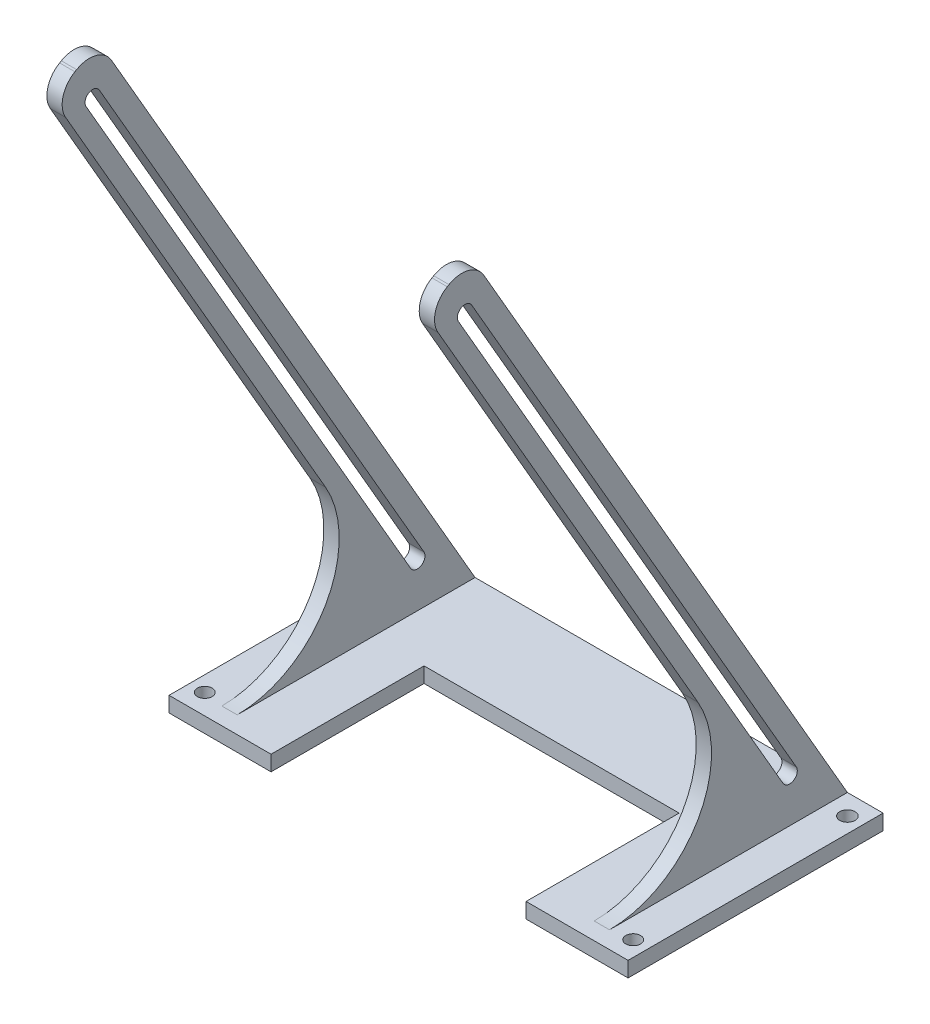
from build123d import *

# Parameters (mm, degrees)
SKETCH_1_R      = 1.448445572
SKETCH_1_R_2    = 1.5
EXTRUDE_1_DEPTH = 3
EXTRUDE_2_DEPTH = 3
SKETCH_5_W      = 10
SKETCH_5_H      = 30
EXTRUDE_3_DEPTH = 3


with BuildPart() as part:
    # 草图1 → 凸台-拉伸1 (new body)
    with BuildSketch(Plane(origin=(0, 0, 0), x_dir=(1, 0, 0), z_dir=(0, 1, 0))):
        Polygon((0, 0), (-35, 0), (-35, -30), (-45, -30), (-45, 20), (45, 20), (45, -30), (35, -30), (35, 0), align=None)
        with Locations(Location((-42, -26, 0), (0, 0, 270))):
            Circle(SKETCH_1_R, mode=Mode.SUBTRACT)
        with Locations(Location((-42, 16, 0), (0, 0, 270))):
            Circle(SKETCH_1_R_2, mode=Mode.SUBTRACT)
        with Locations(Location((42, -26, 0), (0, 0, 90))):
            Circle(SKETCH_1_R, mode=Mode.SUBTRACT)
        with Locations(Location((42, 16, 0), (0, 0, 90))):
            Circle(SKETCH_1_R_2, mode=Mode.SUBTRACT)
    extrude(amount=EXTRUDE_1_DEPTH)

    # 草图2 → 凸台-拉伸2 (add)
    with BuildSketch(Plane(origin=(-35, 0, 0), x_dir=(0, 0, -1), z_dir=(1, 0, 0))):
        with BuildLine():
            Line((-9.320508076, 33), (-60.282676081, 121.269064248))
            ThreePointArc((-60.282676081, 121.269064248), (-60.782178193, 125.063159474), (-58.452549062, 128.099191267))
            Line((-58.452549062, 128.099191267), (-58.1128031, 128.29534369))
            ThreePointArc((-58.1128031, 128.29534369), (-54.318707874, 128.794845803), (-51.282676081, 126.465216671))
            Line((-51.282676081, 126.465216671), (20, 3))
            Line((20, 3), (8, 3))
            Line((8, 3), (-26.641016151, 3))
            ThreePointArc((-26.641016151, 3), (-9.320508076, 13), (-9.320508076, 33))
        make_face()
        with BuildLine():
            Line((-53.673261241, 122.605831628), (9.977098662, 12.360174356))
            ThreePointArc((9.977098662, 12.360174356), (9.428060557, 10.31113625), (7.379022451, 10.860174356))
            Line((7.379022451, 10.860174356), (-56.271337452, 121.105831628))
            ThreePointArc((-56.271337452, 121.105831628), (-55.722299346, 123.154869734), (-53.673261241, 122.605831628))
        make_face(mode=Mode.SUBTRACT)
    extrude_2 = extrude(amount=-EXTRUDE_2_DEPTH)

    # 镜向1: 凸台-拉伸2 across plane
    add(extrude_2.mirror(Plane(origin=(0, 0, 0), x_dir=(0, 0, 1), z_dir=(1, 0, 0))))

    # 草图5 → 凸台-拉伸3 (add)
    with BuildSketch(Plane.XZ):
        with Locations((-30, 15)):
            Rectangle(SKETCH_5_W, SKETCH_5_H)
        with Locations((30, 15)):
            Rectangle(SKETCH_5_W, SKETCH_5_H)
    extrude(amount=-EXTRUDE_3_DEPTH)


solid = part.part
